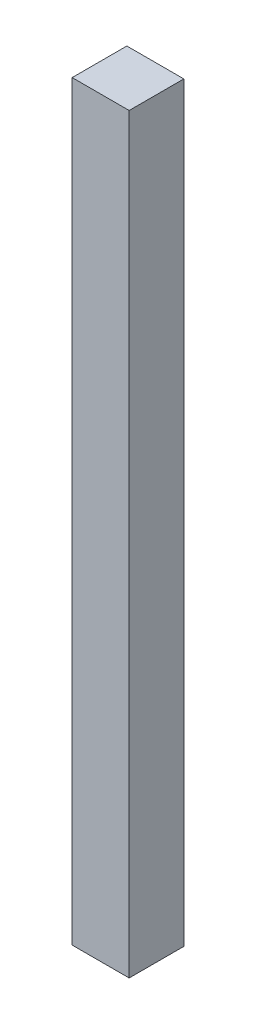
from build123d import *

# Parameters (mm, degrees)
SKETCH1_W           = 16.37600786
SKETCH1_H           = 15.715684963
BOSS_EXTRUDE1_DEPTH = 215.9


with BuildPart() as part:
    # Sketch1 → Boss-Extrude1 (new body)
    with BuildSketch(Plane(origin=(0, 0, 0), x_dir=(1, 0, 0), z_dir=(0, 1, 0))):
        with Locations((8.18800393, 7.857842482)):
            Rectangle(SKETCH1_W, SKETCH1_H)
    extrude(amount=BOSS_EXTRUDE1_DEPTH)


solid = part.part
